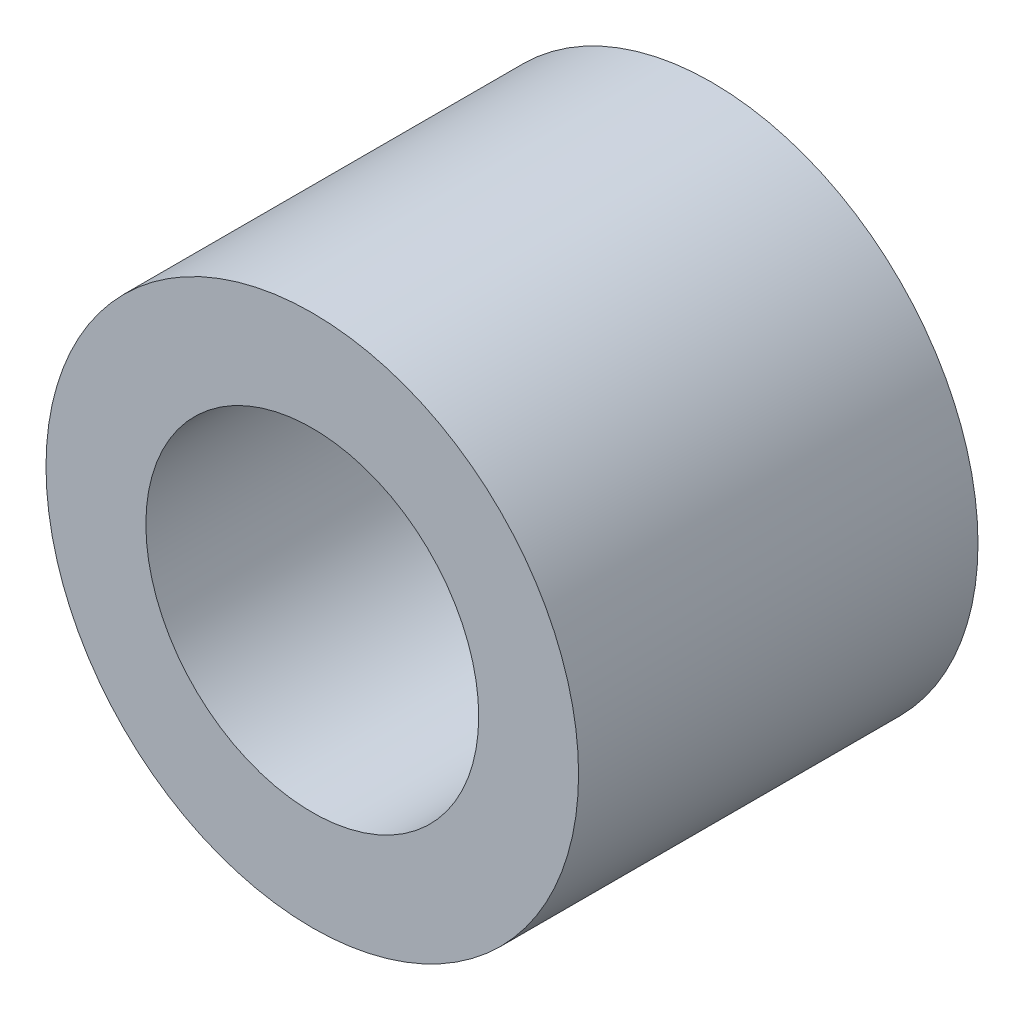
from build123d import *

# Parameters (mm, degrees)
SKETCH1_R           = 4
SKETCH1_R_2         = 2.5
BOSS_EXTRUDE1_DEPTH = 6


with BuildPart() as part:
    # Sketch1 → Boss-Extrude1 (new body)
    with BuildSketch(Plane.XY):
        Circle(SKETCH1_R)
        Circle(SKETCH1_R_2, mode=Mode.SUBTRACT)
    extrude(amount=BOSS_EXTRUDE1_DEPTH)


solid = part.part
